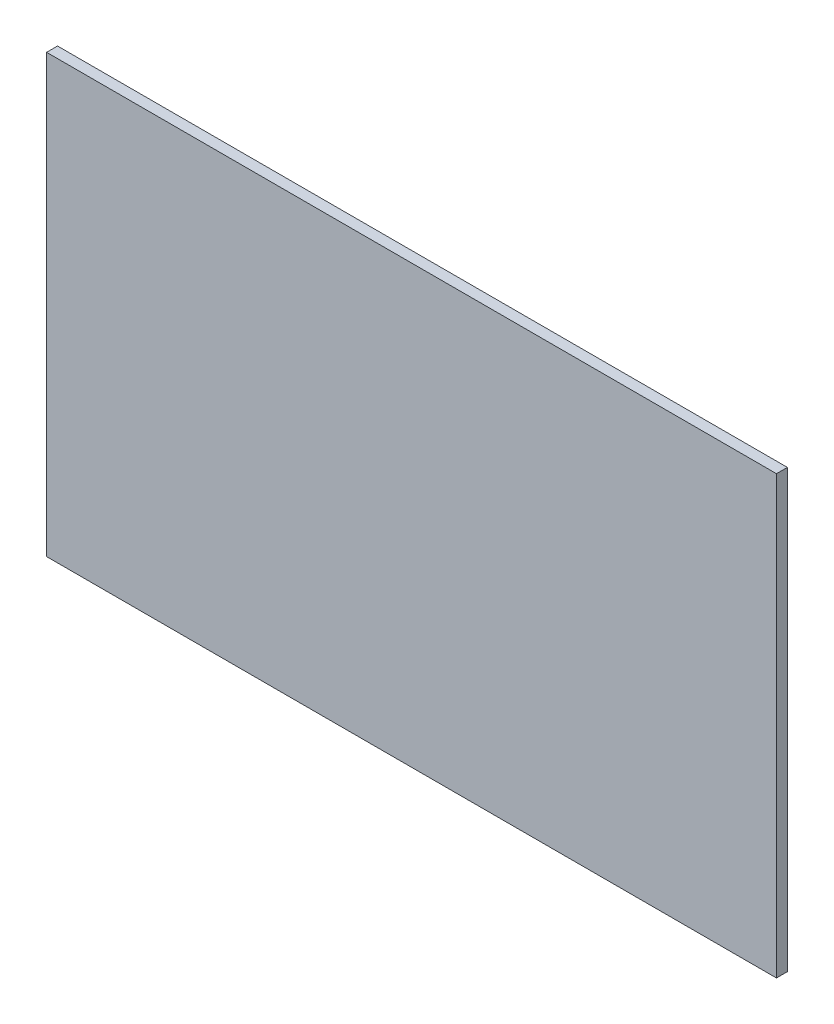
from build123d import *

# Parameters (mm, degrees)
SKETCH_1_W      = 167.117912718
SKETCH_1_H      = 2.5
EXTRUDE_1_DEPTH = 100


with BuildPart() as part:
    # Эскиз1 → Вытянуть1 (new body)
    with BuildSketch(Plane(origin=(0, 0, 0), x_dir=(1, 0, 0), z_dir=(0, 1, 0))):
        with Locations((83.558956359, -1.25)):
            Rectangle(SKETCH_1_W, SKETCH_1_H)
    extrude(amount=EXTRUDE_1_DEPTH)


solid = part.part
